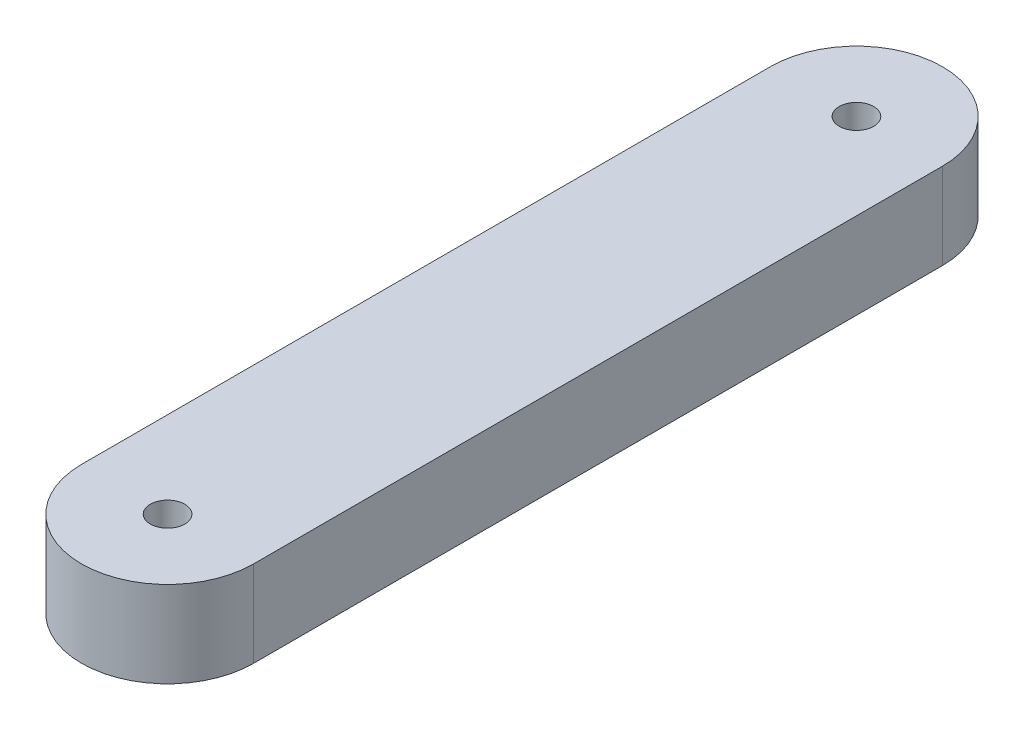
from build123d import *

# Parameters (mm, degrees)
SKETCH2_R           = 1
BOSS_EXTRUDE1_DEPTH = 5


with BuildPart() as part:
    # Sketch2 → Boss-Extrude1 (new body)
    with BuildSketch(Plane(origin=(0, 0, 0), x_dir=(1, 0, 0), z_dir=(0, 1, 0))):
        with BuildLine():
            Line((-5, 40), (-5, 0))
            ThreePointArc((-5, 0), (0, -5), (5, 0))
            Line((5, 0), (5, 40))
            ThreePointArc((5, 40), (0, 45), (-5, 40))
        make_face()
        with Locations(Location((0, 0, 0), (0, 0, 270))):
            Circle(SKETCH2_R, mode=Mode.SUBTRACT)
        with Locations(Location((0, 40, 0), (0, 0, 270))):
            Circle(SKETCH2_R, mode=Mode.SUBTRACT)
    extrude(amount=BOSS_EXTRUDE1_DEPTH)


solid = part.part
